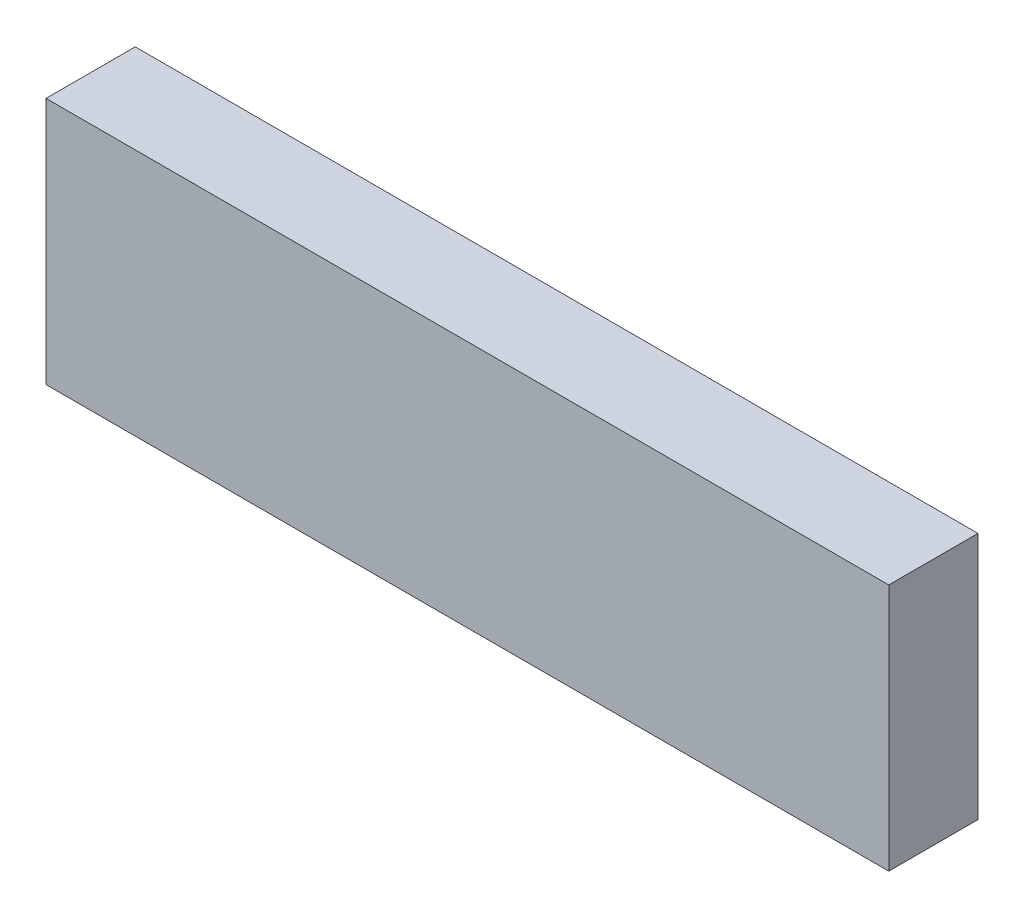
from build123d import *

# Parameters (mm, degrees)
SKETCH1_W           = 215.9
SKETCH1_H           = 22.86
BOSS_EXTRUDE1_DEPTH = 63.5


with BuildPart() as part:
    # Sketch1 → Boss-Extrude1 (new body)
    with BuildSketch(Plane(origin=(0, 0, 0), x_dir=(1, 0, 0), z_dir=(0, 1, 0))):
        with Locations((107.95, 11.43)):
            Rectangle(SKETCH1_W, SKETCH1_H)
    extrude(amount=BOSS_EXTRUDE1_DEPTH)


solid = part.part
